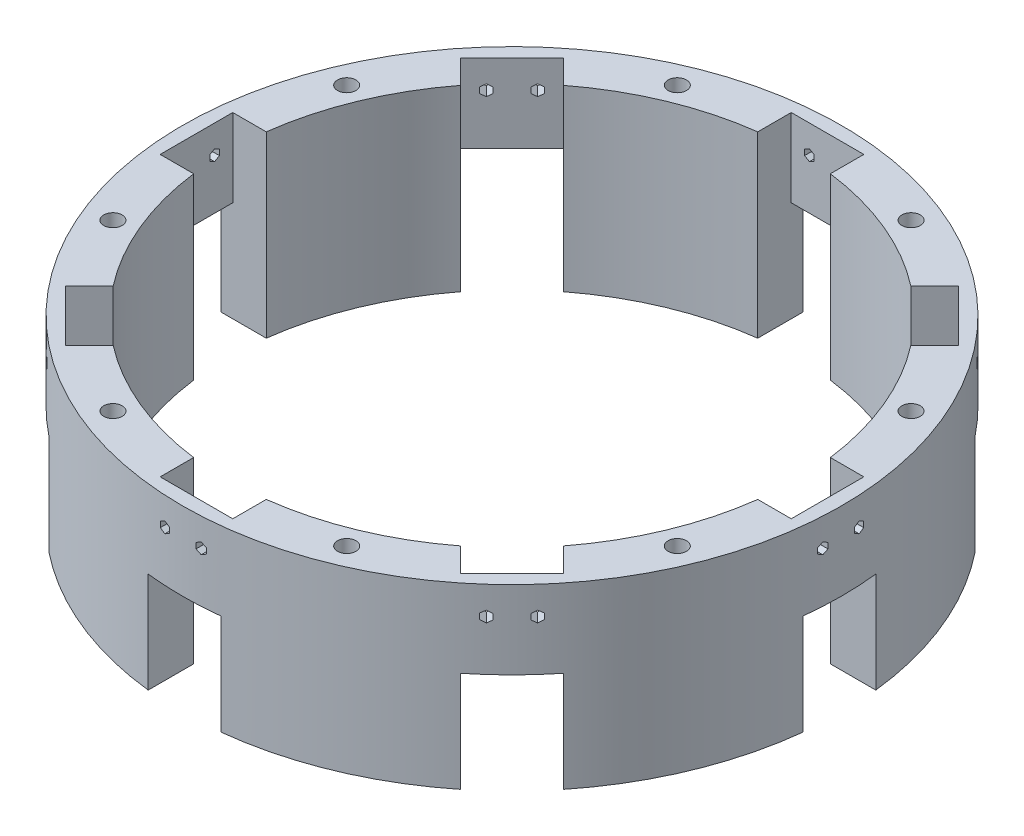
from build123d import *

# Parameters (mm, degrees)
SKETCH1_R           = 62.5
SKETCH1_R_2         = 50.5
BOSS_EXTRUDE1_DEPTH = 32
CUT_EXTRUDE3_DEPTH  = 95.002659537
SKETCH7_R           = 1.65
CUT_EXTRUDE5_DEPTH  = 95.002659537
SKETCH9_W           = 13
SKETCH9_H           = 18
CUT_EXTRUDE6_DEPTH  = 149.380029938
CIRPATTERN1_COUNT   = 8
SKETCH10_R          = 62.5
SKETCH10_R_2        = 59
CUT_EXTRUDE7_DEPTH  = 95.002659537


with BuildPart() as part:
    # Sketch1 → Boss-Extrude1 (new body)
    with BuildSketch(Plane(origin=(0, 0, 0), x_dir=(1, 0, 0), z_dir=(0, 1, 0))):
        with Locations(Location((0, 0, 0), (0, 0, 270))):
            Circle(SKETCH1_R)
        with Locations(Location((0, 0, 0), (0, 0, 270))):
            Circle(SKETCH1_R_2, mode=Mode.SUBTRACT)
    extrude(amount=BOSS_EXTRUDE1_DEPTH)

    # Sketch2 → Cut-Extrude3 (cut, through all)
    with BuildSketch(Plane(origin=(0, 32, 0), x_dir=(1, 0, 0), z_dir=(0, 1, 0))):
        with BuildLine():
            Line((35.355339059, 44.547727215), (31.112698372, 40.305086528))
            ThreePointArc((31.112698372, 40.305086528), (19.484938668, 47.040803194), (6.5, 50.5))
            Line((6.5, 50.5), (6.5, 56.5))
            Line((6.5, 56.5), (-6.5, 56.5))
            Line((-6.5, 56.5), (-6.5, 50.5))
            ThreePointArc((-6.5, 50.5), (-19.484938668, 47.040803194), (-31.112698372, 40.305086528))
            Line((-31.112698372, 40.305086528), (-35.355339059, 44.547727215))
            Line((-35.355339059, 44.547727215), (-44.547727215, 35.355339059))
            Line((-44.547727215, 35.355339059), (-40.305086528, 31.112698372))
            ThreePointArc((-40.305086528, 31.112698372), (-47.040803194, 19.484938668), (-50.5, 6.5))
            Line((-50.5, 6.5), (-56.5, 6.5))
            Line((-56.5, 6.5), (-56.5, -6.5))
            Line((-56.5, -6.5), (-50.5, -6.5))
            ThreePointArc((-50.5, -6.5), (-47.040803194, -19.484938668), (-40.305086528, -31.112698372))
            Line((-40.305086528, -31.112698372), (-44.547727215, -35.355339059))
            Line((-44.547727215, -35.355339059), (-35.355339059, -44.547727215))
            Line((-35.355339059, -44.547727215), (-31.112698372, -40.305086528))
            ThreePointArc((-31.112698372, -40.305086528), (-19.484938668, -47.040803194), (-6.5, -50.5))
            Line((-6.5, -50.5), (-6.5, -56.5))
            Line((-6.5, -56.5), (6.5, -56.5))
            Line((6.5, -56.5), (6.5, -50.5))
            ThreePointArc((6.5, -50.5), (19.484938668, -47.040803194), (31.112698372, -40.305086528))
            Line((31.112698372, -40.305086528), (35.355339059, -44.547727215))
            Line((35.355339059, -44.547727215), (44.547727215, -35.355339059))
            Line((44.547727215, -35.355339059), (40.305086528, -31.112698372))
            ThreePointArc((40.305086528, -31.112698372), (47.040803194, -19.484938668), (50.5, -6.5))
            Line((50.5, -6.5), (56.5, -6.5))
            Line((56.5, -6.5), (56.5, 6.5))
            Line((56.5, 6.5), (50.5, 6.5))
            ThreePointArc((50.5, 6.5), (47.040803194, 19.484938668), (40.305086528, 31.112698372))
            Line((40.305086528, 31.112698372), (44.547727215, 35.355339059))
            Line((44.547727215, 35.355339059), (35.355339059, 44.547727215))
        make_face()
    extrude(amount=-CUT_EXTRUDE3_DEPTH, mode=Mode.SUBTRACT)

    # Sketch7 → Cut-Extrude5 (cut, through all)
    with BuildSketch(Plane.XZ):
        with Locations(Location((-20.92766953, 50.523863607, 0), (0, 0, 270))):
            Circle(SKETCH7_R)
        with Locations(Location((-50.523863607, 20.92766953, 0), (0, 0, 270))):
            Circle(SKETCH7_R)
        with Locations(Location((20.92766953, 50.523863607, 0), (0, 0, 270))):
            Circle(SKETCH7_R)
        with Locations(Location((50.523863607, 20.92766953, 0), (0, 0, 270))):
            Circle(SKETCH7_R)
        with Locations(Location((50.523863607, -20.92766953, 0), (0, 0, 270))):
            Circle(SKETCH7_R)
        with Locations(Location((20.92766953, -50.523863607, 0), (0, 0, 270))):
            Circle(SKETCH7_R)
        with Locations(Location((-20.92766953, -50.523863607, 0), (0, 0, 270))):
            Circle(SKETCH7_R)
        with Locations(Location((-50.523863607, -20.92766953, 0), (0, 0, 270))):
            Circle(SKETCH7_R)
    extrude(amount=-CUT_EXTRUDE5_DEPTH, mode=Mode.SUBTRACT)

    # Sketch9 → Cut-Extrude6 (cut, through all)
    with BuildSketch(Plane(origin=(39.951533137, 0, -39.951533137), x_dir=(0.707106781186548, 0, 0.7071067811865471), z_dir=(-0.7071067811865471, 0, 0.707106781186548))):
        Polygon((-3.25, 28), (-4.116025404, 27.5), (-4.116025404, 26.5), (-3.25, 26), (-2.383974596, 26.5), (-2.383974596, 27.5), align=None)
        Polygon((3.25, 28), (2.383974596, 27.5), (2.383974596, 26.5), (3.25, 26), (4.116025404, 26.5), (4.116025404, 27.5), align=None)
        with Locations((0, 9)):
            Rectangle(SKETCH9_W, SKETCH9_H)
    cut_extrude6 = extrude(amount=-CUT_EXTRUDE6_DEPTH, mode=Mode.SUBTRACT)

    # CirPattern1: Cut-Extrude6 ×8 about axis
    cirpattern1_axis = Axis((0, 0, 0), (0, 1, 0))
    for i in range(1, CIRPATTERN1_COUNT):
        add(cut_extrude6.rotate(cirpattern1_axis, i * 360 / CIRPATTERN1_COUNT), mode=Mode.SUBTRACT)

    # Sketch10 → Cut-Extrude7 (cut, through all)
    with BuildSketch(Plane(origin=(0, 32, 0), x_dir=(1, 0, 0), z_dir=(0, 1, 0))):
        Circle(SKETCH10_R)
        with Locations(Location((0, 0, 0), (0, 0, 270))):
            Circle(SKETCH10_R_2, mode=Mode.SUBTRACT)
    extrude(amount=-CUT_EXTRUDE7_DEPTH, mode=Mode.SUBTRACT)


solid = part.part
